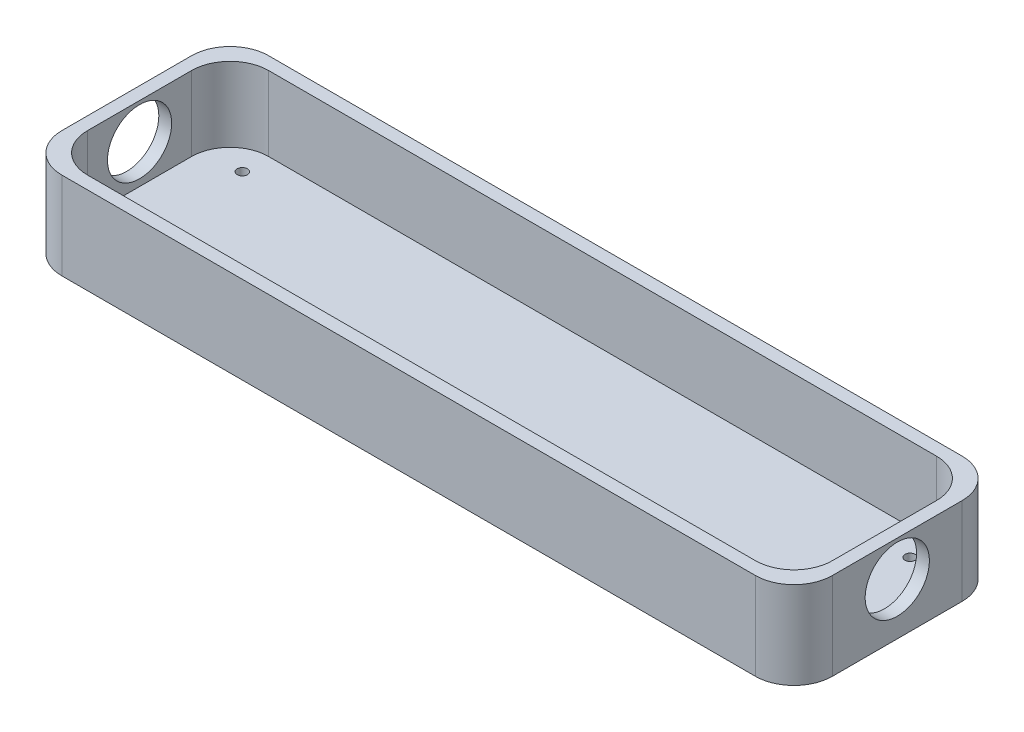
from build123d import *

# Parameters (mm, degrees)
SKETCH1_W               = 300
SKETCH1_H               = 80.5
SKETCH1_W_2             = 290
SKETCH1_H_2             = 70.5
BOSS_EXTRUDE1_DEPTH     = 34
SKETCH1_3_W             = 290
SKETCH1_3_H             = 70.5
BOSS_EXTRUDE2_DEPTH     = 5
FILLET1_R               = 15
FILLET2_R               = 15
FILLET3_R               = 15
FILLET4_R               = 15
FILLET5_R               = 15
FILLET6_R               = 15
FILLET7_R               = 15
FILLET8_R               = 15
SKETCH2_R               = 2
CUT_EXTRUDE1_DEPTH      = 159.984472512
MIRROR2_COPY_1_SKETCH_R = 2
MIRROR2_COPY_1_DEPTH    = 159.984472512
SKETCH3_R               = 12.5
CUT_EXTRUDE2_DEPTH      = 305.591632354


with BuildPart() as part:
    # Sketch1 → Boss-Extrude1 (new body)
    with BuildSketch(Plane(origin=(0, 0, 0), x_dir=(1, 0, 0), z_dir=(0, 1, 0))):
        Rectangle(SKETCH1_W, SKETCH1_H)
        Rectangle(SKETCH1_W_2, SKETCH1_H_2, mode=Mode.SUBTRACT)
    extrude(amount=BOSS_EXTRUDE1_DEPTH)

    # Sketch1<3> → Boss-Extrude2 (add)
    with BuildSketch(Plane(origin=(0, 0, 0), x_dir=(1, 0, 0), z_dir=(0, 1, 0))):
        Rectangle(SKETCH1_3_W, SKETCH1_3_H)
    extrude(amount=BOSS_EXTRUDE2_DEPTH)

    # Fillet1
    fillet1_edges = [part.edges().sort_by_distance(p)[0] for p in [
        (-150, 17, 40.25),
    ]]
    fillet(fillet1_edges, radius=FILLET1_R)

    # Fillet2
    fillet2_edges = [part.edges().sort_by_distance(p)[0] for p in [
        (-150, 17, -40.25),
    ]]
    fillet(fillet2_edges, radius=FILLET2_R)

    # Fillet3
    fillet3_edges = [part.edges().sort_by_distance(p)[0] for p in [
        (150, 17, -40.25),
    ]]
    fillet(fillet3_edges, radius=FILLET3_R)

    # Fillet4
    fillet4_edges = [part.edges().sort_by_distance(p)[0] for p in [
        (150, 17, 40.25),
    ]]
    fillet(fillet4_edges, radius=FILLET4_R)

    # Fillet5
    fillet5_edges = [part.edges().sort_by_distance(p)[0] for p in [
        (-145, 19.5, -35.25),
    ]]
    fillet(fillet5_edges, radius=FILLET5_R)

    # Fillet6
    fillet6_edges = [part.edges().sort_by_distance(p)[0] for p in [
        (-145, 19.5, 35.25),
    ]]
    fillet(fillet6_edges, radius=FILLET6_R)

    # Fillet7
    fillet7_edges = [part.edges().sort_by_distance(p)[0] for p in [
        (145, 19.5, -35.25),
    ]]
    fillet(fillet7_edges, radius=FILLET7_R)

    # Fillet8
    fillet8_edges = [part.edges().sort_by_distance(p)[0] for p in [
        (145, 19.5, 35.25),
    ]]
    fillet(fillet8_edges, radius=FILLET8_R)

    # Sketch2 → Cut-Extrude1 (cut, through all)
    with BuildSketch(Plane(origin=(0, 0, 0), x_dir=(-1, 0, 0), z_dir=(0, -1, 0))):
        with Locations((-130, -25)):
            Circle(SKETCH2_R)
    cut_extrude1 = extrude(amount=-CUT_EXTRUDE1_DEPTH, mode=Mode.SUBTRACT)

    # Mirror1: Cut-Extrude1 across plane
    add(cut_extrude1.mirror(Plane.XY), mode=Mode.SUBTRACT)

    # Mirror2: Cut-Extrude1 across plane
    add(cut_extrude1.mirror(Plane(origin=(0, 0, 0), x_dir=(0, 0, 1), z_dir=(1, 0, 0))), mode=Mode.SUBTRACT)

    # Mirror2 copy 1 sketch → Mirror2 copy 1 (cut, through all)
    with BuildSketch(Plane.XZ):
        with Locations((-130, -25)):
            Circle(MIRROR2_COPY_1_SKETCH_R)
    extrude(amount=-MIRROR2_COPY_1_DEPTH, mode=Mode.SUBTRACT)

    # Sketch3 → Cut-Extrude2 (cut, through all)
    with BuildSketch(Plane(origin=(150, 0, 0), x_dir=(0, 0, -1), z_dir=(1, 0, 0))):
        with Locations((0, 20.125)):
            Circle(SKETCH3_R)
    extrude(amount=-CUT_EXTRUDE2_DEPTH, mode=Mode.SUBTRACT)


solid = part.part
